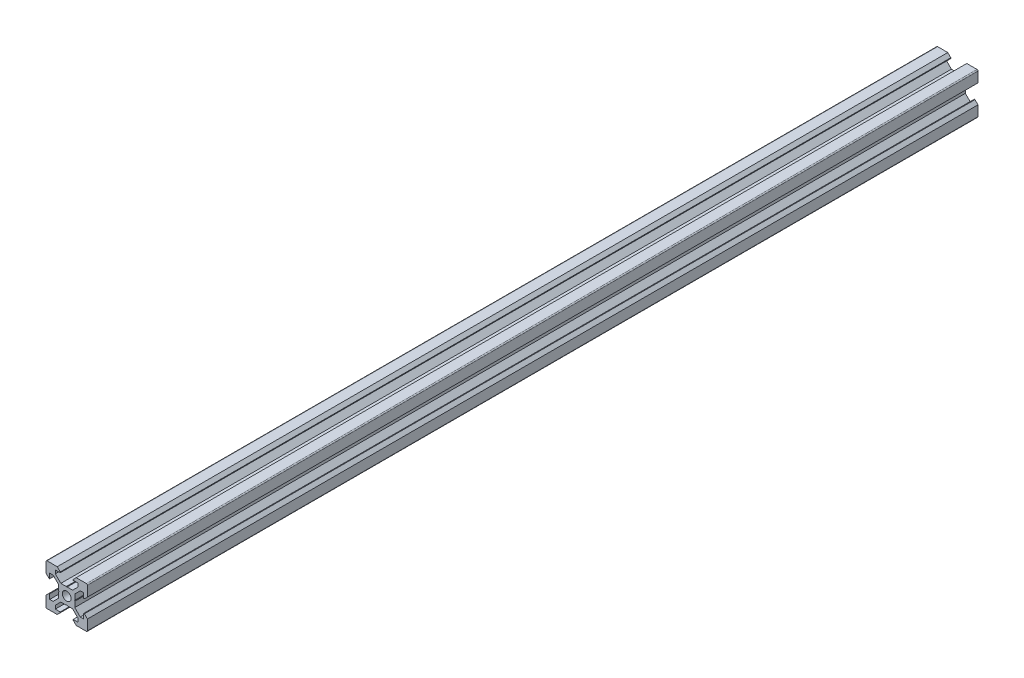
from build123d import *

# Parameters (mm, degrees)
SKETCH1_R           = 2.1
BOSS_EXTRUDE1_DEPTH = 430


with BuildPart() as part:
    # Sketch1 → Boss-Extrude1 (new body)
    with BuildSketch(Plane.XY):
        with BuildLine():
            Line((4.58, -10), (9.5, -10))
            ThreePointArc((9.5, -10), (9.853553391, -9.853553391), (10, -9.5))
            Line((10, -9.5), (10, -4.58))
            Line((10, -4.58), (8.545, -3.125))
            Line((8.545, -3.125), (8.2, -3.125))
            Line((8.2, -3.125), (8.2, -5.5))
            Line((8.2, -5.5), (6.560660172, -5.5))
            Line((6.560660172, -5.5), (3.9, -2.839339828))
            Line((3.9, -2.839339828), (3.9, -0.21))
            Line((3.9, -0.21), (3.69, 0))
            Line((3.69, 0), (3.9, 0.21))
            Line((3.9, 0.21), (3.9, 2.839339828))
            Line((3.9, 2.839339828), (6.560660172, 5.5))
            Line((6.560660172, 5.5), (8.2, 5.5))
            Line((8.2, 5.5), (8.2, 3.125))
            Line((8.2, 3.125), (8.545, 3.125))
            Line((8.545, 3.125), (10, 4.58))
            Line((10, 4.58), (10, 9.5))
            ThreePointArc((10, 9.5), (9.853553391, 9.853553391), (9.5, 10))
            Line((9.5, 10), (4.58, 10))
            Line((4.58, 10), (3.125, 8.545))
            Line((3.125, 8.545), (3.125, 8.2))
            Line((3.125, 8.2), (5.5, 8.2))
            Line((5.5, 8.2), (5.5, 6.560660172))
            Line((5.5, 6.560660172), (2.839339828, 3.9))
            Line((2.839339828, 3.9), (0.21, 3.9))
            Line((0.21, 3.9), (0, 3.69))
            Line((0, 3.69), (-0.21, 3.9))
            Line((-0.21, 3.9), (-2.839339828, 3.9))
            Line((-2.839339828, 3.9), (-5.5, 6.560660172))
            Line((-5.5, 6.560660172), (-5.5, 8.2))
            Line((-5.5, 8.2), (-3.125, 8.2))
            Line((-3.125, 8.2), (-3.125, 8.545))
            Line((-3.125, 8.545), (-4.58, 10))
            Line((-4.58, 10), (-9.5, 10))
            ThreePointArc((-9.5, 10), (-9.853553391, 9.853553391), (-10, 9.5))
            Line((-10, 9.5), (-10, 4.58))
            Line((-10, 4.58), (-8.545, 3.125))
            Line((-8.545, 3.125), (-8.2, 3.125))
            Line((-8.2, 3.125), (-8.2, 5.5))
            Line((-8.2, 5.5), (-6.560660172, 5.5))
            Line((-6.560660172, 5.5), (-3.9, 2.839339828))
            Line((-3.9, 2.839339828), (-3.9, 0.21))
            Line((-3.9, 0.21), (-3.69, 0))
            Line((-3.69, 0), (-3.9, -0.21))
            Line((-3.9, -0.21), (-3.9, -2.839339828))
            Line((-3.9, -2.839339828), (-6.560660172, -5.5))
            Line((-6.560660172, -5.5), (-8.2, -5.5))
            Line((-8.2, -5.5), (-8.2, -3.125))
            Line((-8.2, -3.125), (-8.545, -3.125))
            Line((-8.545, -3.125), (-10, -4.58))
            Line((-10, -4.58), (-10, -9.5))
            ThreePointArc((-10, -9.5), (-9.853553391, -9.853553391), (-9.5, -10))
            Line((-9.5, -10), (-4.58, -10))
            Line((-4.58, -10), (-3.125, -8.545))
            Line((-3.125, -8.545), (-3.125, -8.2))
            Line((-3.125, -8.2), (-5.5, -8.2))
            Line((-5.5, -8.2), (-5.5, -6.560660172))
            Line((-5.5, -6.560660172), (-2.839339828, -3.9))
            Line((-2.839339828, -3.9), (-0.21, -3.9))
            Line((-0.21, -3.9), (0, -3.69))
            Line((0, -3.69), (0.21, -3.9))
            Line((0.21, -3.9), (2.839339828, -3.9))
            Line((2.839339828, -3.9), (5.5, -6.560660172))
            Line((5.5, -6.560660172), (5.5, -8.2))
            Line((5.5, -8.2), (3.125, -8.2))
            Line((3.125, -8.2), (3.125, -8.545))
            Line((3.125, -8.545), (4.58, -10))
        make_face()
        Circle(SKETCH1_R, mode=Mode.SUBTRACT)
    extrude(amount=BOSS_EXTRUDE1_DEPTH)


solid = part.part
